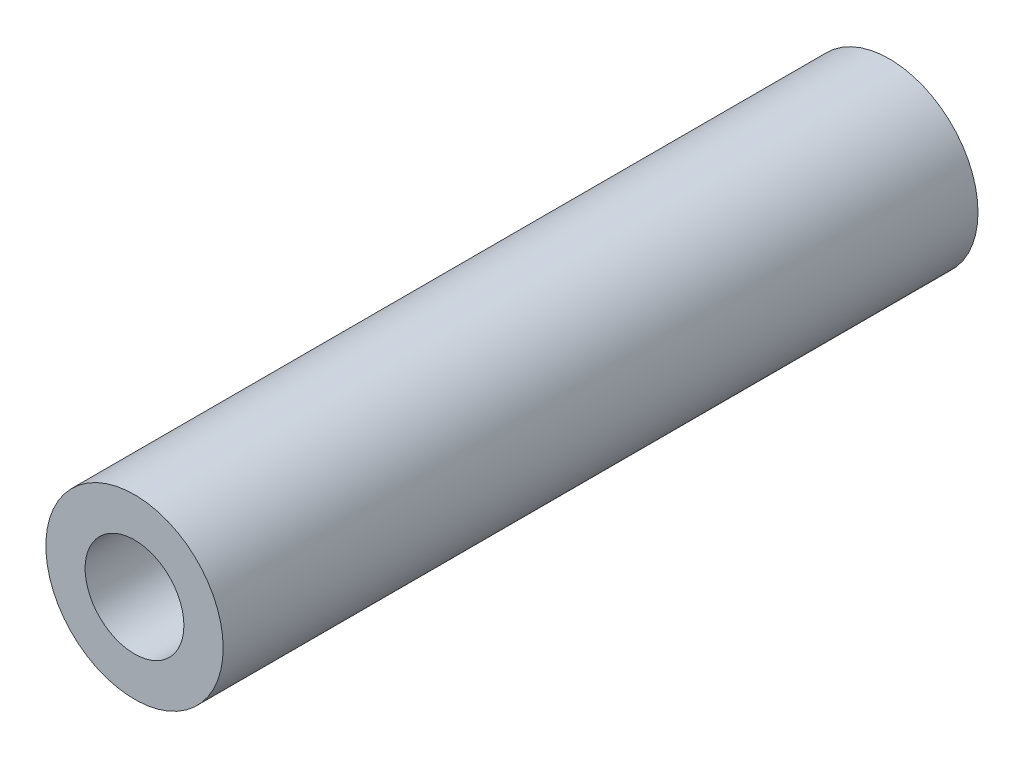
from build123d import *

# Parameters (mm, degrees)
CROQUIS1_R              = 17.5
CROQUIS1_R_2            = 9.75
SALIENTE_EXTRUIR1_DEPTH = 149


with BuildPart() as part:
    # Croquis1 → Saliente-Extruir1 (new body)
    with BuildSketch(Plane.XY):
        Circle(CROQUIS1_R)
        Circle(CROQUIS1_R_2, mode=Mode.SUBTRACT)
    extrude(amount=SALIENTE_EXTRUIR1_DEPTH)


solid = part.part
